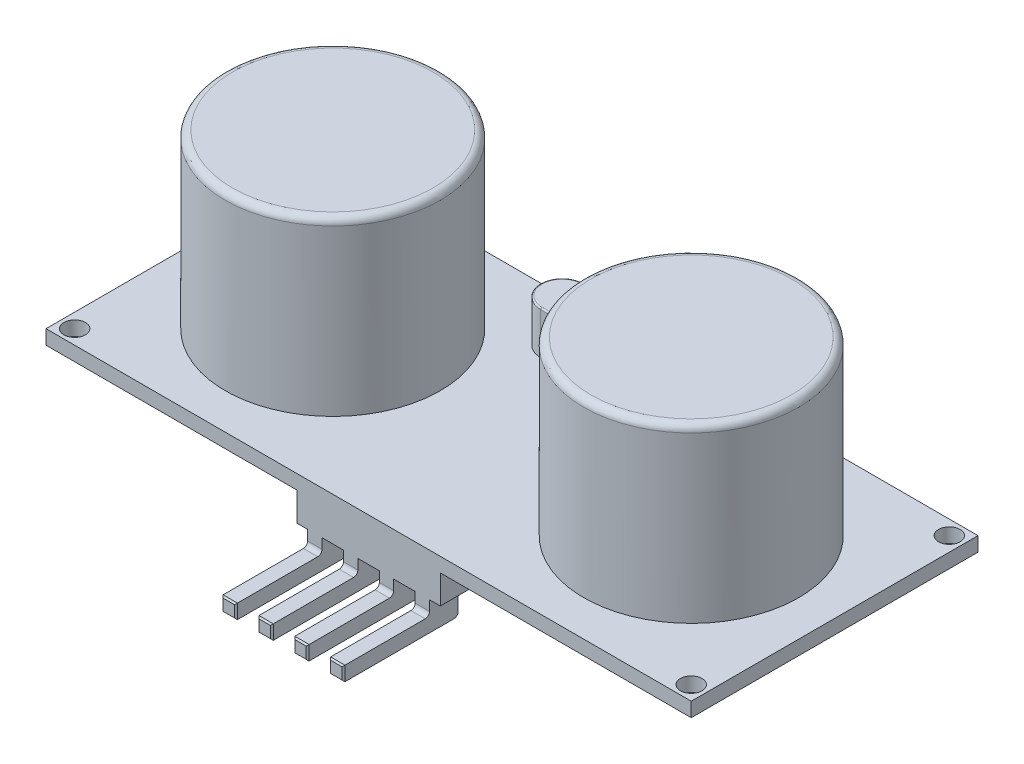
from build123d import *

# Parameters (mm, degrees)
ESQUISSE1_W               = 45
ESQUISSE1_H               = 20
BOSS_EXTRU_1_DEPTH        = 1
ENL_V_MAT_EXTRU_1_REACH   = 26.642
ESQUISSE2_R               = 0.75
SYM_TRIE2_COPY_1_REACH    = 26.642
SYM_TRIE2_COPY_1_SKETCH_R = 0.75
ESQUISSE3_R               = 7.5
BOSS_EXTRU_2_DEPTH        = 12
CONG_1_R                  = 0.5
BOSS_EXTRU_3_DEPTH        = 3
CONG_2_R                  = 0.1
ESQUISSE5_W               = 10
ESQUISSE5_H               = 2
BOSS_EXTRU_4_DEPTH        = 4
ESQUISSE6_W               = 10
ESQUISSE6_H               = 1
BOSS_EXTRU_5_DEPTH        = 6
ENL_V_MAT_EXTRU_2_REACH   = 33.611
ESQUISSE7_W               = 1.5
ESQUISSE7_H               = 2
ESQUISSE7_W_2             = 0.75
CHANFREIN1_SIZE           = 0.1
CONG_3_R                  = 0.3


with BuildPart() as part:
    # Esquisse1 → Boss.-Extru.1 (new body)
    with BuildSketch(Plane(origin=(0, 0, 0), x_dir=(1, 0, 0), z_dir=(0, 1, 0))):
        Rectangle(ESQUISSE1_W, ESQUISSE1_H)
    extrude(amount=BOSS_EXTRU_1_DEPTH)

    # Esquisse2 → Enlèv. mat.-Extru.1 (cut, up to next)
    with BuildSketch(Plane(origin=(0, 1, 0), x_dir=(1, 0, 0), z_dir=(0, 1, 0)), mode=Mode.PRIVATE) as enl_v_mat_extru_1_sk1:
        with Locations(Location((-21.5, 9, 0), (0, 0, 270))):
            Circle(ESQUISSE2_R)
    enl_v_mat_extru_1_tool1 = extrude(enl_v_mat_extru_1_sk1.sketch, amount=-ENL_V_MAT_EXTRU_1_REACH, mode=Mode.PRIVATE) & part.part
    enl_v_mat_extru_1 = enl_v_mat_extru_1_tool1.solids().sort_by_distance((-21.5, 1, -9))[0]
    add(enl_v_mat_extru_1, mode=Mode.SUBTRACT)

    # Symétrie1: Enlèv. mat.-Extru.1 across plane
    add(enl_v_mat_extru_1.mirror(Plane(origin=(0, 0, 0), x_dir=(0, 0, 1), z_dir=(1, 0, 0))), mode=Mode.SUBTRACT)

    # Symétrie2: Enlèv. mat.-Extru.1 across plane
    add(enl_v_mat_extru_1.mirror(Plane.XY), mode=Mode.SUBTRACT)

    # Symétrie2 copy 1 sketch → Symétrie2 copy 1 (cut, up to next)
    with BuildSketch(Plane(origin=(0, 1, 0), x_dir=(-1, 0, 0), z_dir=(0, 1, 0)), mode=Mode.PRIVATE) as sym_trie2_copy_1_sk1:
        with Locations(Location((-21.5, 9, 0), (0, 0, 270))):
            Circle(SYM_TRIE2_COPY_1_SKETCH_R)
    sym_trie2_copy_1_tool1 = extrude(sym_trie2_copy_1_sk1.sketch, amount=-SYM_TRIE2_COPY_1_REACH, mode=Mode.PRIVATE) & part.part
    add(sym_trie2_copy_1_tool1.solids().sort_by_distance((21.5, 1, 9))[0], mode=Mode.SUBTRACT)

    # Esquisse3 → Boss.-Extru.2 (add)
    with BuildSketch(Plane(origin=(0, 1, 0), x_dir=(1, 0, 0), z_dir=(0, 1, 0))):
        with Locations(Location((-12.5, 0, 0), (0, 0, 90))):
            Circle(ESQUISSE3_R)
        with Locations(Location((12.5, 0, 0), (0, 0, 90))):
            Circle(ESQUISSE3_R)
    extrude(amount=BOSS_EXTRU_2_DEPTH)

    # Congé1
    cong_1_edges = [part.edges().sort_by_distance(p)[0] for p in [
        (-12.5, 13, 7.5),
        (12.5, 13, 7.5),
    ]]
    fillet(cong_1_edges, radius=CONG_1_R)

    # Esquisse4 → Boss.-Extru.3 (add)
    with BuildSketch(Plane(origin=(0, 1, 0), x_dir=(1, 0, 0), z_dir=(0, 1, 0))):
        with BuildLine():
            Line((-3.5, 8.5), (3.5, 8.5))
            ThreePointArc((3.5, 8.5), (5, 7), (3.5, 5.5))
            Line((3.5, 5.5), (-3.5, 5.5))
            ThreePointArc((-3.5, 5.5), (-5, 7), (-3.5, 8.5))
        make_face()
    extrude(amount=BOSS_EXTRU_3_DEPTH)

    # Congé2
    cong_2_edges = [part.edges().sort_by_distance(p)[0] for p in [
        (-5, 4, -7),
        (0, 4, -5.5),
        (5, 4, -7),
        (0, 4, -8.5),
    ]]
    fillet(cong_2_edges, radius=CONG_2_R)

    # Esquisse5 → Boss.-Extru.4 (add)
    with BuildSketch(Plane.XZ):
        with Locations((0, 9)):
            Rectangle(ESQUISSE5_W, ESQUISSE5_H)
    extrude(amount=BOSS_EXTRU_4_DEPTH)

    # Esquisse6 → Boss.-Extru.5 (add)
    with BuildSketch(Plane.XY.offset(10)):
        with Locations((0, -3.5)):
            Rectangle(ESQUISSE6_W, ESQUISSE6_H)
    extrude(amount=BOSS_EXTRU_5_DEPTH)

    # Esquisse7 → Enlèv. mat.-Extru.2 (cut, up to next)
    with BuildSketch(Plane(origin=(0, 0, 8), x_dir=(-1, 0, 0), z_dir=(0, 0, -1)), mode=Mode.PRIVATE) as enl_v_mat_extru_2_sk1:
        with Locations((-2.5, -3)):
            Rectangle(ESQUISSE7_W, ESQUISSE7_H)
    enl_v_mat_extru_2_tool1 = extrude(enl_v_mat_extru_2_sk1.sketch, amount=-ENL_V_MAT_EXTRU_2_REACH, mode=Mode.PRIVATE) & part.part
    # Esquisse7 → Enlèv. mat.-Extru.2 (cut, up to next)
    with BuildSketch(Plane(origin=(0, 0, 8), x_dir=(-1, 0, 0), z_dir=(0, 0, -1)), mode=Mode.PRIVATE) as enl_v_mat_extru_2_sk2:
        with Locations((-4.625, -3)):
            Rectangle(ESQUISSE7_W_2, ESQUISSE7_H)
    enl_v_mat_extru_2_tool2 = extrude(enl_v_mat_extru_2_sk2.sketch, amount=-ENL_V_MAT_EXTRU_2_REACH, mode=Mode.PRIVATE) & part.part
    # Esquisse7 → Enlèv. mat.-Extru.2 (cut, up to next)
    with BuildSketch(Plane(origin=(0, 0, 8), x_dir=(-1, 0, 0), z_dir=(0, 0, -1)), mode=Mode.PRIVATE) as enl_v_mat_extru_2_sk3:
        with Locations((0, -3)):
            Rectangle(ESQUISSE7_W, ESQUISSE7_H)
    enl_v_mat_extru_2_tool3 = extrude(enl_v_mat_extru_2_sk3.sketch, amount=-ENL_V_MAT_EXTRU_2_REACH, mode=Mode.PRIVATE) & part.part
    # Esquisse7 → Enlèv. mat.-Extru.2 (cut, up to next)
    with BuildSketch(Plane(origin=(0, 0, 8), x_dir=(-1, 0, 0), z_dir=(0, 0, -1)), mode=Mode.PRIVATE) as enl_v_mat_extru_2_sk4:
        with Locations((2.5, -3)):
            Rectangle(ESQUISSE7_W, ESQUISSE7_H)
    enl_v_mat_extru_2_tool4 = extrude(enl_v_mat_extru_2_sk4.sketch, amount=-ENL_V_MAT_EXTRU_2_REACH, mode=Mode.PRIVATE) & part.part
    # Esquisse7 → Enlèv. mat.-Extru.2 (cut, up to next)
    with BuildSketch(Plane(origin=(0, 0, 8), x_dir=(-1, 0, 0), z_dir=(0, 0, -1)), mode=Mode.PRIVATE) as enl_v_mat_extru_2_sk5:
        with Locations((4.625, -3)):
            Rectangle(ESQUISSE7_W_2, ESQUISSE7_H)
    enl_v_mat_extru_2_tool5 = extrude(enl_v_mat_extru_2_sk5.sketch, amount=-ENL_V_MAT_EXTRU_2_REACH, mode=Mode.PRIVATE) & part.part
    add(enl_v_mat_extru_2_tool1.solids().sort_by_distance((2.5, -3, 8))[0], mode=Mode.SUBTRACT)
    add(enl_v_mat_extru_2_tool2.solids().sort_by_distance((4.625, -3, 8))[0], mode=Mode.SUBTRACT)
    add(enl_v_mat_extru_2_tool3.solids().sort_by_distance((0, -3, 8))[0], mode=Mode.SUBTRACT)
    add(enl_v_mat_extru_2_tool4.solids().sort_by_distance((-2.5, -3, 8))[0], mode=Mode.SUBTRACT)
    add(enl_v_mat_extru_2_tool5.solids().sort_by_distance((-4.625, -3, 8))[0], mode=Mode.SUBTRACT)

    # Chanfrein1
    chanfrein1_edges = [part.edges().sort_by_distance(p)[0] for p in [
        (-3.75, -3, 16),
        (-4.25, -3.5, 16),
        (-1.75, -3.5, 16),
        (-3.25, -3.5, 16),
        (0.75, -3.5, 16),
        (-0.75, -3.5, 16),
        (4.25, -3.5, 16),
        (3.25, -3.5, 16),
        (1.75, -3.5, 16),
        (-3.75, -4, 16),
        (-1.25, -4, 16),
        (1.25, -4, 16),
        (3.75, -4, 16),
        (3.75, -3, 16),
        (1.25, -3, 16),
        (-1.25, -3, 16),
    ]]
    chamfer(chanfrein1_edges, length=CHANFREIN1_SIZE)

    # Congé3
    cong_3_edges = [part.edges().sort_by_distance(p)[0] for p in [
        (3.75, -3, 10),
        (1.25, -3, 10),
        (-1.25, -3, 10),
        (-3.75, -3, 10),
        (-3.75, -4, 8),
        (-1.25, -4, 8),
        (1.25, -4, 8),
        (3.75, -4, 8),
    ]]
    fillet(cong_3_edges, radius=CONG_3_R)


solid = part.part
